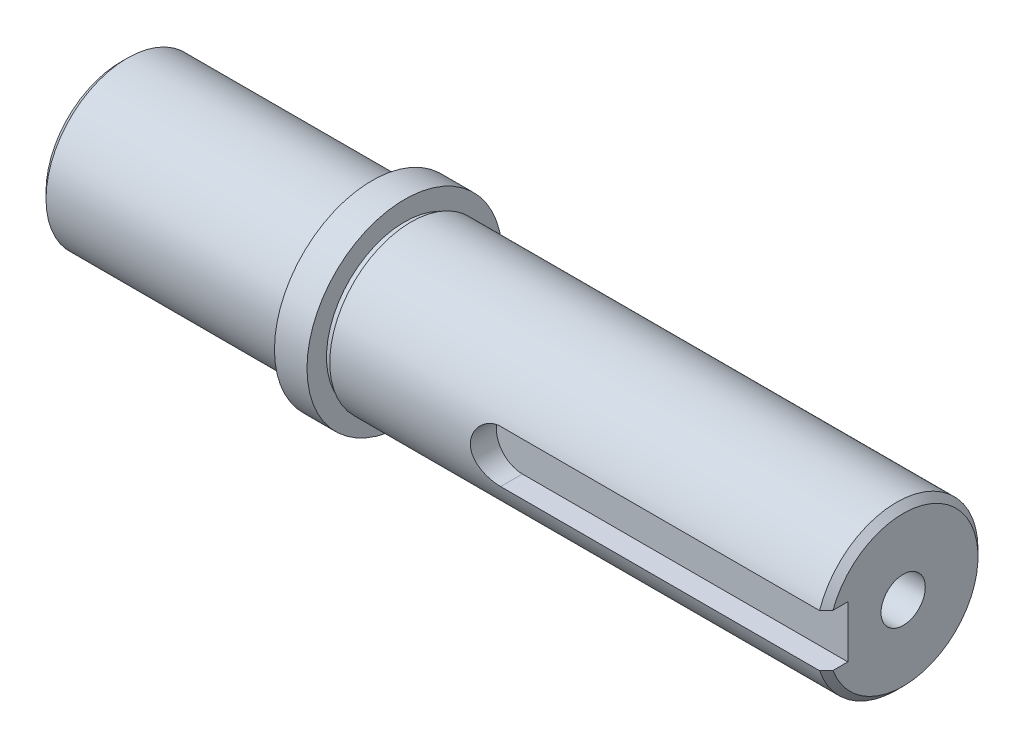
from build123d import *

# Parameters (mm, degrees)
CHAMFER1_SIZE         = 1
CUT_EXTRUDE1_DEPTH    = 4
CUT_EXTRUDE2_DEPTH    = 10
M8_TAPPED_HOLE1_D     = 6.8
M8_TAPPED_HOLE1_DEPTH = 19.75
M8_TAPPED_HOLE1_TIP   = 2.042926105
CHAMFER2_SIZE         = 1


with BuildPart() as part:
    # Sketch1 → Revolve1 (revolve)
    with BuildSketch(Plane.XY, mode=Mode.PRIVATE) as revolve1_sk:
        Polygon((0, 0), (0, 12.5), (38.6, 12.5), (38.6, 15), (43.6, 15), (43.6, 12), (44.6, 12), (44.6, 12.5), (120.2, 12.5), (120.2, 0), align=None)
    revolve(revolve1_sk.sketch.rotate(Axis((0, 0, 0), (-1, 0, 0)), 90), axis=Axis((0, 0, 0), (-1, 0, 0)))

    # Chamfer1
    chamfer1_edges = [part.edges().sort_by_distance(p)[0] for p in [
        (0, 0, 12.5),
    ]]
    chamfer(chamfer1_edges, length=CHAMFER1_SIZE)

    # Sketch3 → Cut-Extrude1 (cut)
    with BuildSketch(Plane(origin=(120.2, 2.936266506, 12.5), x_dir=(1, 0, 0), z_dir=(0, 0, -1))):
        with BuildLine():
            Line((-5, 6.936266506), (-50, 6.936266506))
            ThreePointArc((-50, 6.936266506), (-54, 2.936266506), (-50, -1.063733494))
            Line((-50, -1.063733494), (-5, -1.063733494))
            ThreePointArc((-5, -1.063733494), (-1, 2.936266506), (-5, 6.936266506))
        make_face()
    extrude(amount=CUT_EXTRUDE1_DEPTH, mode=Mode.SUBTRACT)

    # Sketch4 → Cut-Extrude2 (cut)
    with BuildSketch(Plane(origin=(120.2, 0, 0), x_dir=(0, 0, -1), z_dir=(1, 0, 0))):
        with BuildLine():
            Line((-8.5, -4), (-8.5, 4))
            Line((-8.5, 4), (-11.842719282, 4))
            ThreePointArc((-11.842719282, 4), (-12.5, 0), (-11.842719282, -4))
            Line((-11.842719282, -4), (-8.5, -4))
        make_face()
    extrude(amount=-CUT_EXTRUDE2_DEPTH, mode=Mode.SUBTRACT)

    # M8 Tapped Hole1
    with Locations(Plane(origin=(120.2, 0, 0), x_dir=(0, 0, -1), z_dir=(1, 0, 0))):
        with Locations((0, 0)):
            Hole(M8_TAPPED_HOLE1_D / 2, depth=M8_TAPPED_HOLE1_DEPTH)
            with Locations((0, 0, -(M8_TAPPED_HOLE1_DEPTH + M8_TAPPED_HOLE1_TIP / 2))):  # 118° drill point
                Cone(0, M8_TAPPED_HOLE1_D / 2, M8_TAPPED_HOLE1_TIP, mode=Mode.SUBTRACT)

    # Chamfer2
    chamfer2_edges = [part.edges().sort_by_distance(p)[0] for p in [
        (120.2, 12.33458534, -2.026821276),
    ]]
    chamfer(chamfer2_edges, length=CHAMFER2_SIZE)


solid = part.part
